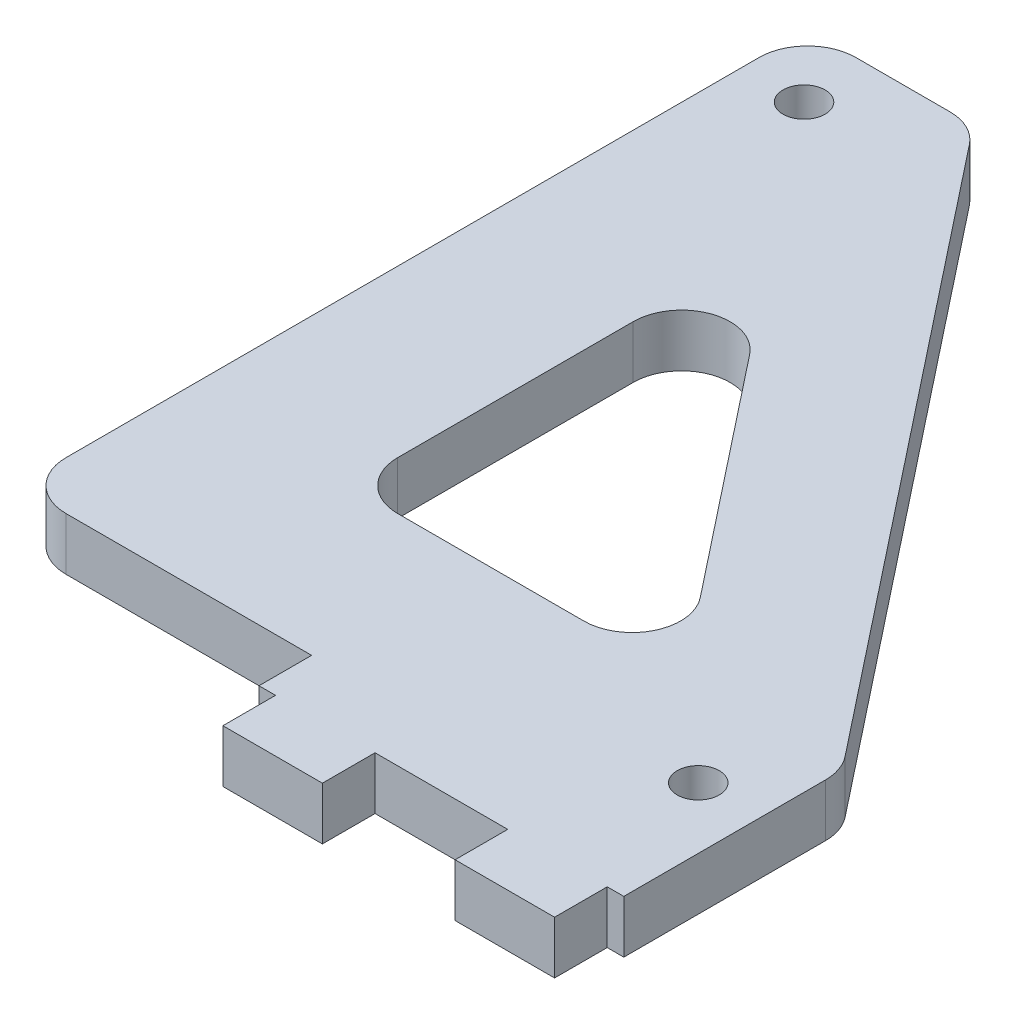
from build123d import *

# Parameters (mm, degrees)
SKETCH1_R           = 1.27
BOSS_EXTRUDE1_DEPTH = 3.175
FILLET1_R           = 2.921
SKETCH5_W           = 22
SKETCH5_H           = 3.175
BOSS_EXTRUDE3_DEPTH = 3.175
SKETCH2_W           = 6
SKETCH2_H           = 3.175
BOSS_EXTRUDE2_DEPTH = 3.175


with BuildPart() as part:
    # Sketch1 → Boss-Extrude1 (new body)
    with BuildSketch(Plane(origin=(0, 0, 0), x_dir=(1, 0, 0), z_dir=(0, 1, 0))):
        Polygon((0, 0), (0, 47.63), (10, 47.63), (39.73, 10), (39.73, 0), align=None)
        with Locations(Location((3.683, 43.74, 0), (0, 0, 270))):
            Circle(SKETCH1_R, mode=Mode.SUBTRACT)
        with Locations(Location((36.043, 5, 0), (0, 0, 270))):
            Circle(SKETCH1_R, mode=Mode.SUBTRACT)
        Polygon((10, 35.531824847), (10, 10), (30.171702171, 10), align=None, mode=Mode.SUBTRACT)
    extrude(amount=BOSS_EXTRUDE1_DEPTH)

    # Fillet1
    fillet1_edges = [part.edges().sort_by_distance(p)[0] for p in [
        (10, 1.5875, -10),
        (30.171702171, 1.5875, -10),
        (10, 1.5875, -35.531824847),
        (0, 1.5875, 0),
        (0, 1.5875, -47.63),
        (10, 1.5875, -47.63),
        (39.73, 1.5875, -10),
    ]]
    fillet(fillet1_edges, radius=FILLET1_R)

    # Sketch5 → Boss-Extrude3 (add)
    with BuildSketch(Plane.XY):
        with Locations((28.73, 1.5875)):
            Rectangle(SKETCH5_W, SKETCH5_H)
    extrude(amount=BOSS_EXTRUDE3_DEPTH)

    # Sketch2 → Boss-Extrude2 (add)
    with BuildSketch(Plane.XY.offset(3.175)):
        with Locations((21.73, 1.5875)):
            Rectangle(SKETCH2_W, SKETCH2_H)
        with Locations((35.73, 1.5875)):
            Rectangle(SKETCH2_W, SKETCH2_H)
    extrude(amount=BOSS_EXTRUDE2_DEPTH)


solid = part.part
